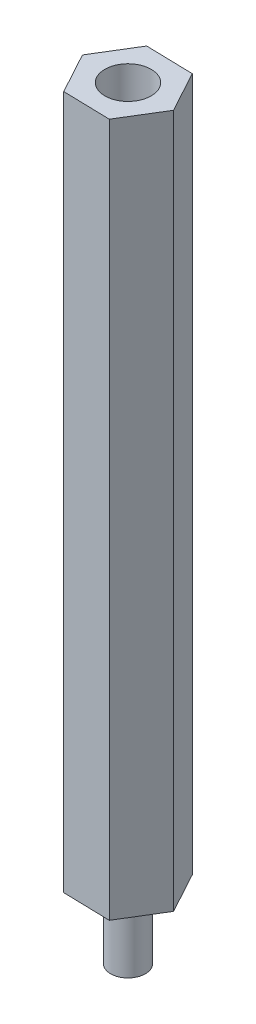
from build123d import *

# Parameters (mm, degrees)
EXTRUDE_1_DEPTH     = 60
SKETCH_2_R          = 2
CUT_EXTRUDE_1_DEPTH = 8
SKETCH_3_R          = 1.5
EXTRUDE_2_DEPTH     = 6


with BuildPart() as part:
    # 스케치1 → 보스-돌출1 (new body)
    with BuildSketch(Plane(origin=(0, 0, 0), x_dir=(1, 0, 0), z_dir=(0, 1, 0))):
        Polygon((1.931599116, -3.549965942), (4.040160246, -0.102169067), (2.108561131, 3.447796875), (-1.931599116, 3.549965942), (-4.040160246, 0.102169067), (-2.108561131, -3.447796875), align=None)
    extrude(amount=EXTRUDE_1_DEPTH)

    # 스케치2 → 컷-돌출1 (cut)
    with BuildSketch(Plane(origin=(0, 60, 0), x_dir=(1, 0, 0), z_dir=(0, 1, 0))):
        with Locations(Location((0, 0, 0), (0, 0, 270))):
            Circle(SKETCH_2_R)
    extrude(amount=-CUT_EXTRUDE_1_DEPTH, mode=Mode.SUBTRACT)

    # 스케치3 → 보스-돌출2 (add)
    with BuildSketch(Plane.XZ):
        with Locations(Location((0, 0, 0), (0, 0, 270))):
            Circle(SKETCH_3_R)
    extrude(amount=EXTRUDE_2_DEPTH)


solid = part.part
